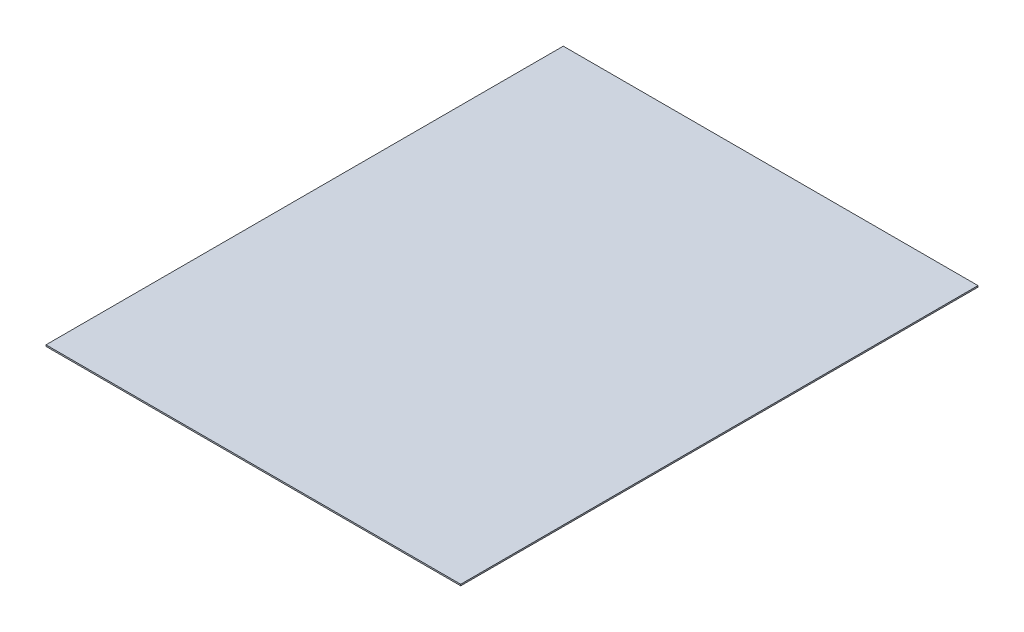
from build123d import *

# Parameters (mm, degrees)
SKETCH1_W           = 7404.21729635
SKETCH1_H           = 9235.484530821
BOSS_EXTRUDE1_DEPTH = 25.4


with BuildPart() as part:
    # Sketch1 → Boss-Extrude1 (new body)
    with BuildSketch(Plane(origin=(0, 0, 0), x_dir=(1, 0, 0), z_dir=(0, 1, 0))):
        with Locations((3702.108648175, 4617.742265411)):
            Rectangle(SKETCH1_W, SKETCH1_H)
    extrude(amount=BOSS_EXTRUDE1_DEPTH)


solid = part.part
